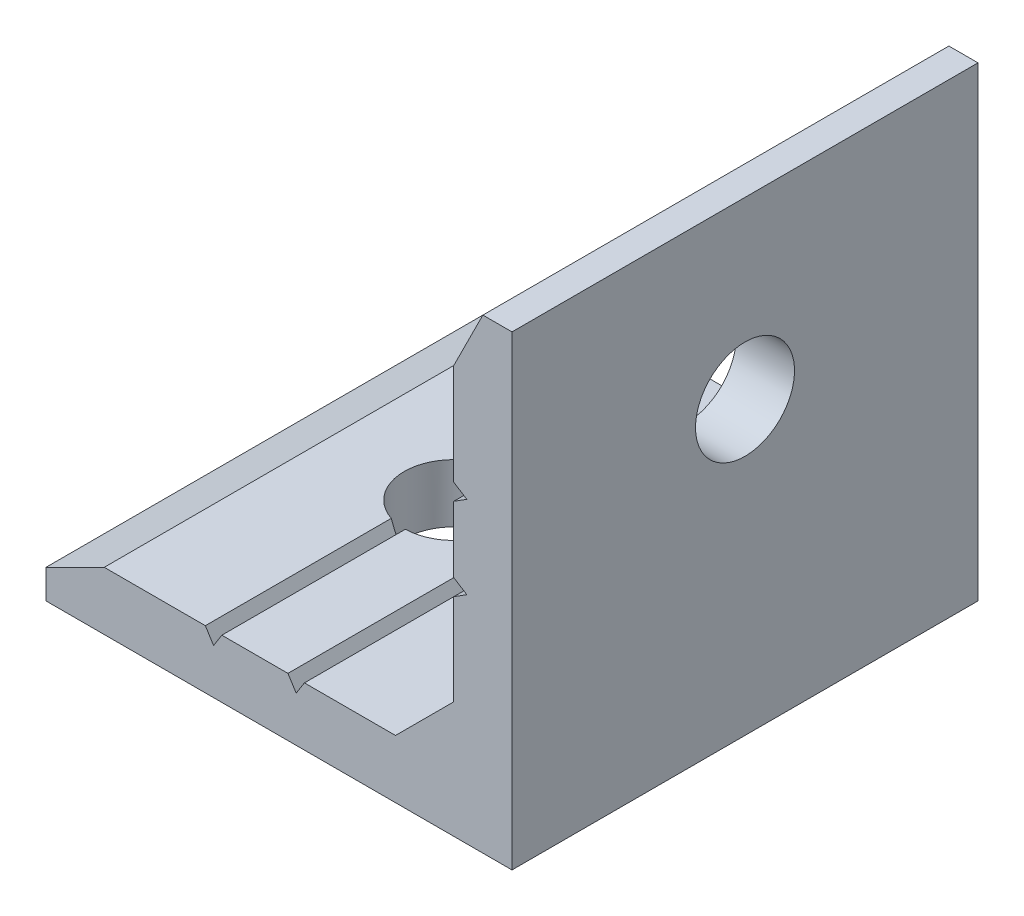
from build123d import *

# Parameters (mm, degrees)
EXTRUDE_1_DEPTH     = 40
CHAMFER_1_SIZE      = 5
SKETCH_3_R          = 4.25
CUT_EXTRUDE_1_DEPTH = 67.520673478
SKETCH_4_R          = 4.25
CUT_EXTRUDE_2_DEPTH = 40


with BuildPart() as part:
    # 草图1 → 凸台-拉伸1 (new body)
    with BuildSketch(Plane.XY):
        Polygon((0, 0), (40, 0), (40, 40), (37.5, 40), (35, 35), (35, 26.322499125), (36.120266103, 25.614016347), (35, 24.905533569), (35, 19.233332915), (36.120266103, 18.524850137), (35, 17.816367359), (35, 5), (22.183632641, 5), (21.475149863, 3.879733897), (20.766667085, 5), (15.094466431, 5), (14.385983653, 3.879733897), (13.677500875, 5), (5, 5), (0, 2.5), align=None)
    extrude(amount=EXTRUDE_1_DEPTH)

    # 倒角1
    chamfer_1_edges = [part.edges().sort_by_distance(p)[0] for p in [
        (35, 5, 20),
    ]]
    chamfer(chamfer_1_edges, length=CHAMFER_1_SIZE)

    # 草图3 → 切除-拉伸1 (cut, through all)
    with BuildSketch(Plane(origin=(0, 5, 0), x_dir=(1, 0, 0), z_dir=(0, 1, 0))):
        with Locations(Location((15, -20, 0), (0, 0, 180))):
            Circle(SKETCH_3_R)
    extrude(amount=-CUT_EXTRUDE_1_DEPTH, mode=Mode.SUBTRACT)

    # 草图4 → 切除-拉伸2 (cut)
    with BuildSketch(Plane.ZY.offset(-35)):
        with Locations((20, 25)):
            Circle(SKETCH_4_R)
    extrude(amount=-CUT_EXTRUDE_2_DEPTH, mode=Mode.SUBTRACT)


solid = part.part
